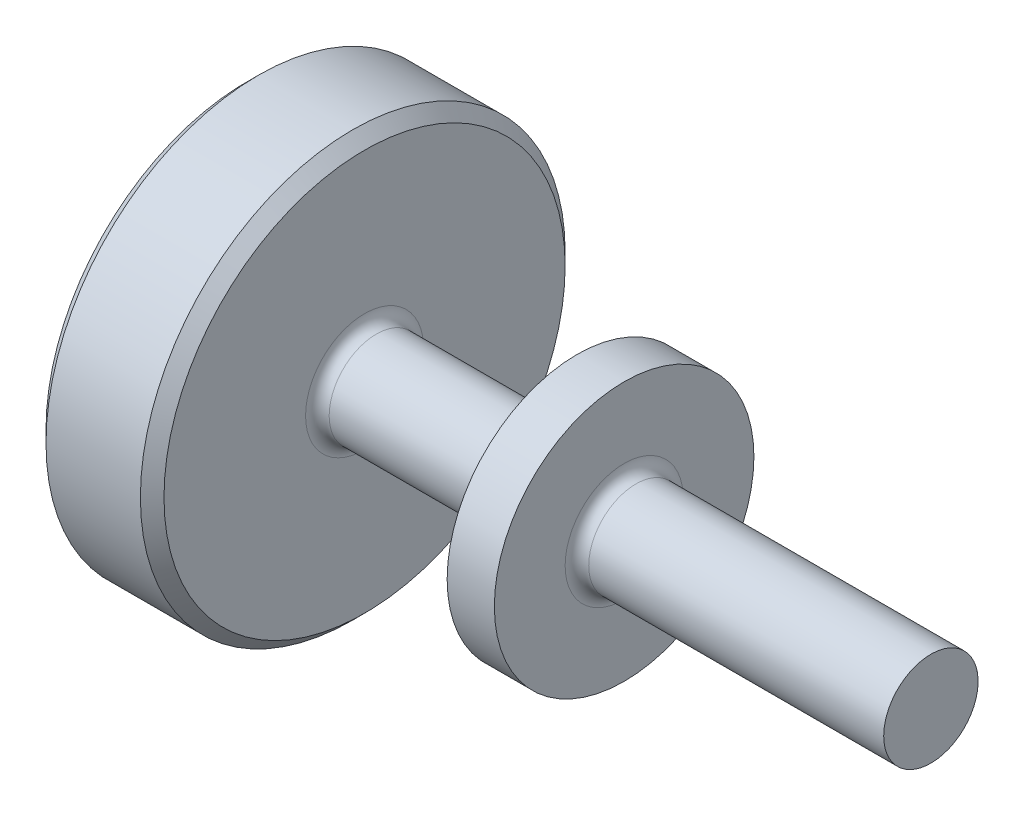
from build123d import *

# Parameters (mm, degrees)
CHAMFER1_SIZE = 1
FILLET1_R     = 1


with BuildPart() as part:
    # Sketch1 → Revolve1 (revolve)
    with BuildSketch(Plane.XY, mode=Mode.PRIVATE) as revolve1_sk:
        Polygon((0, 0), (0, 18), (10, 18), (10, 4), (28, 4), (28, 11), (32, 11), (32, 4), (58, 4), (58, 0), align=None)
    revolve(revolve1_sk.sketch.rotate(Axis((0, 0, 0), (1, 0, 0)), 90), axis=Axis((0, 0, 0), (1, 0, 0)))

    # Chamfer1
    chamfer1_edges = [part.edges().sort_by_distance(p)[0] for p in [
        (10, 0, -18),
        (0, 0, -18),
    ]]
    chamfer(chamfer1_edges, length=CHAMFER1_SIZE)

    # Fillet1
    fillet1_edges = [part.edges().sort_by_distance(p)[0] for p in [
        (28, 0, -4),
        (10, 0, -4),
        (32, 0, -4),
    ]]
    fillet(fillet1_edges, radius=FILLET1_R)


solid = part.part
